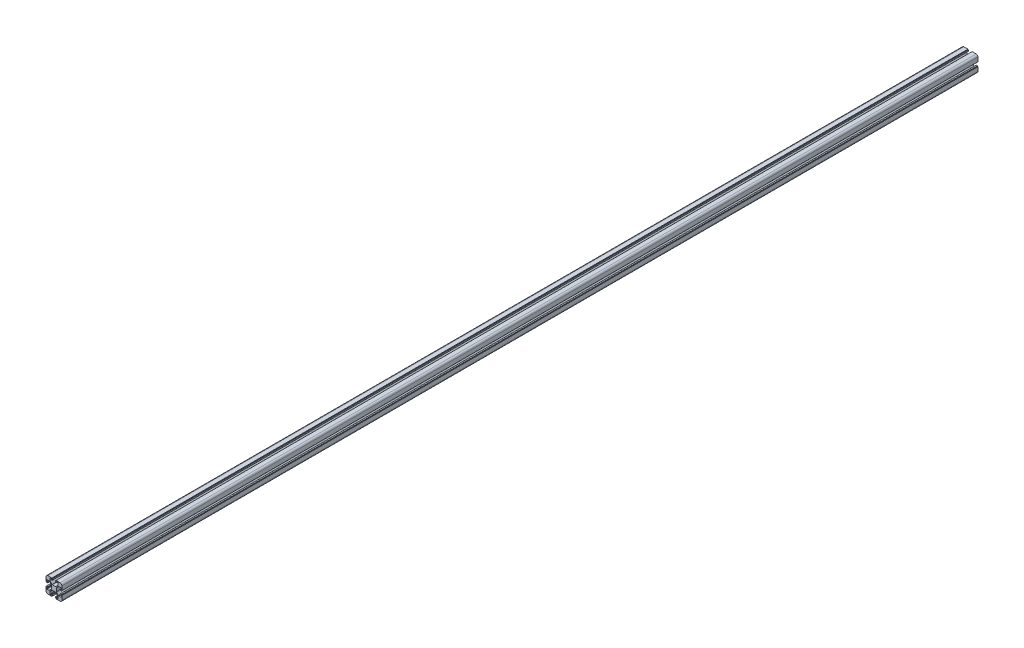
from build123d import *

# Parameters (mm, degrees)
SKETCH2_R           = 3.4
BOSS_EXTRUDE1_DEPTH = 50
BOSS_EXTRUDE2_DEPTH = 2250


with BuildPart() as part:
    # Sketch2 → Boss-Extrude1 (new body)
    with BuildSketch(Plane.XY):
        with BuildLine():
            Line((4.5, 0), (14.7, 0))
            ThreePointArc((14.7, 0), (14.841421356, 0.058578644), (14.9, 0.2))
            Line((14.9, 0.2), (14.9, 0.8))
            ThreePointArc((14.9, 0.8), (14.958578644, 0.941421356), (15.1, 1))
            Line((15.1, 1), (15.7, 1))
            ThreePointArc((15.7, 1), (15.841421356, 1.058578644), (15.9, 1.2))
            Line((15.9, 1.2), (15.9, 4.2))
            ThreePointArc((15.9, 4.2), (15.812132034, 4.412132034), (15.6, 4.5))
            Line((15.6, 4.5), (13.9, 4.5))
            ThreePointArc((13.9, 4.5), (13.687867966, 4.412132034), (13.6, 4.2))
            Line((13.6, 4.2), (13.6, 2.5))
            ThreePointArc((13.6, 2.5), (13.307106781, 1.792893219), (12.6, 1.5))
            Line((12.6, 1.5), (10.75, 1.5))
            ThreePointArc((10.75, 1.5), (10.042893219, 1.792893219), (9.75, 2.5))
            Line((9.75, 2.5), (9.75, 7.507359313))
            ThreePointArc((9.75, 7.507359313), (9.902240935, 8.272726178), (10.335786438, 8.921572875))
            Line((10.335786438, 8.921572875), (14.828427125, 13.414213562))
            ThreePointArc((14.828427125, 13.414213562), (15.477273822, 13.847759065), (16.242640687, 14))
            Line((16.242640687, 14), (23.757359313, 14))
            ThreePointArc((23.757359313, 14), (24.522726178, 13.847759065), (25.171572875, 13.414213562))
            Line((25.171572875, 13.414213562), (29.664213562, 8.921572875))
            ThreePointArc((29.664213562, 8.921572875), (30.097759065, 8.272726178), (30.25, 7.507359313))
            Line((30.25, 7.507359313), (30.25, 2.5))
            ThreePointArc((30.25, 2.5), (29.957106781, 1.792893219), (29.25, 1.5))
            Line((29.25, 1.5), (27.4, 1.5))
            ThreePointArc((27.4, 1.5), (26.692893219, 1.792893219), (26.4, 2.5))
            Line((26.4, 2.5), (26.4, 4.2))
            ThreePointArc((26.4, 4.2), (26.312132034, 4.412132034), (26.1, 4.5))
            Line((26.1, 4.5), (24.4, 4.5))
            ThreePointArc((24.4, 4.5), (24.187867966, 4.412132034), (24.1, 4.2))
            Line((24.1, 4.2), (24.1, 1.2))
            ThreePointArc((24.1, 1.2), (24.158578644, 1.058578644), (24.3, 1))
            Line((24.3, 1), (24.9, 1))
            ThreePointArc((24.9, 1), (25.041421356, 0.941421356), (25.1, 0.8))
            Line((25.1, 0.8), (25.1, 0.2))
            ThreePointArc((25.1, 0.2), (25.158578644, 0.058578644), (25.3, 0))
            Line((25.3, 0), (35.5, 0))
            ThreePointArc((35.5, 0), (38.681980515, 1.318019485), (40, 4.5))
            Line((40, 4.5), (40, 14.7))
            ThreePointArc((40, 14.7), (39.941421356, 14.841421356), (39.8, 14.9))
            Line((39.8, 14.9), (39.2, 14.9))
            ThreePointArc((39.2, 14.9), (39.058578644, 14.958578644), (39, 15.1))
            Line((39, 15.1), (39, 15.7))
            ThreePointArc((39, 15.7), (38.941421356, 15.841421356), (38.8, 15.9))
            Line((38.8, 15.9), (35.8, 15.9))
            ThreePointArc((35.8, 15.9), (35.587867966, 15.812132034), (35.5, 15.6))
            Line((35.5, 15.6), (35.5, 13.9))
            ThreePointArc((35.5, 13.9), (35.587867966, 13.687867966), (35.8, 13.6))
            Line((35.8, 13.6), (37.5, 13.6))
            ThreePointArc((37.5, 13.6), (38.207106781, 13.307106781), (38.5, 12.6))
            Line((38.5, 12.6), (38.5, 10.75))
            ThreePointArc((38.5, 10.75), (38.207106781, 10.042893219), (37.5, 9.75))
            Line((37.5, 9.75), (32.492640687, 9.75))
            ThreePointArc((32.492640687, 9.75), (31.727273822, 9.902240935), (31.078427125, 10.335786438))
            Line((31.078427125, 10.335786438), (26.585786438, 14.828427125))
            ThreePointArc((26.585786438, 14.828427125), (26.152240935, 15.477273822), (26, 16.242640687))
            Line((26, 16.242640687), (26, 23.757359313))
            ThreePointArc((26, 23.757359313), (26.152240935, 24.522726178), (26.585786438, 25.171572875))
            Line((26.585786438, 25.171572875), (31.078427125, 29.664213562))
            ThreePointArc((31.078427125, 29.664213562), (31.727273822, 30.097759065), (32.492640687, 30.25))
            Line((32.492640687, 30.25), (37.5, 30.25))
            ThreePointArc((37.5, 30.25), (38.207106781, 29.957106781), (38.5, 29.25))
            Line((38.5, 29.25), (38.5, 27.4))
            ThreePointArc((38.5, 27.4), (38.207106781, 26.692893219), (37.5, 26.4))
            Line((37.5, 26.4), (35.8, 26.4))
            ThreePointArc((35.8, 26.4), (35.587867966, 26.312132034), (35.5, 26.1))
            Line((35.5, 26.1), (35.5, 24.4))
            ThreePointArc((35.5, 24.4), (35.587867966, 24.187867966), (35.8, 24.1))
            Line((35.8, 24.1), (38.8, 24.1))
            ThreePointArc((38.8, 24.1), (38.941421356, 24.158578644), (39, 24.3))
            Line((39, 24.3), (39, 24.9))
            ThreePointArc((39, 24.9), (39.058578644, 25.041421356), (39.2, 25.1))
            Line((39.2, 25.1), (39.8, 25.1))
            ThreePointArc((39.8, 25.1), (39.941421356, 25.158578644), (40, 25.3))
            Line((40, 25.3), (40, 35.5))
            ThreePointArc((40, 35.5), (38.681980515, 38.681980515), (35.5, 40))
            Line((35.5, 40), (25.3, 40))
            ThreePointArc((25.3, 40), (25.158578644, 39.941421356), (25.1, 39.8))
            Line((25.1, 39.8), (25.1, 39.2))
            ThreePointArc((25.1, 39.2), (25.041421356, 39.058578644), (24.9, 39))
            Line((24.9, 39), (24.3, 39))
            ThreePointArc((24.3, 39), (24.158578644, 38.941421356), (24.1, 38.8))
            Line((24.1, 38.8), (24.1, 35.8))
            ThreePointArc((24.1, 35.8), (24.187867966, 35.587867966), (24.4, 35.5))
            Line((24.4, 35.5), (26.1, 35.5))
            ThreePointArc((26.1, 35.5), (26.312132034, 35.587867966), (26.4, 35.8))
            Line((26.4, 35.8), (26.4, 37.5))
            ThreePointArc((26.4, 37.5), (26.692893219, 38.207106781), (27.4, 38.5))
            Line((27.4, 38.5), (29.25, 38.5))
            ThreePointArc((29.25, 38.5), (29.957106781, 38.207106781), (30.25, 37.5))
            Line((30.25, 37.5), (30.25, 32.492640687))
            ThreePointArc((30.25, 32.492640687), (30.097759065, 31.727273822), (29.664213562, 31.078427125))
            Line((29.664213562, 31.078427125), (25.171572875, 26.585786438))
            ThreePointArc((25.171572875, 26.585786438), (24.522726178, 26.152240935), (23.757359313, 26))
            Line((23.757359313, 26), (16.242640687, 26))
            ThreePointArc((16.242640687, 26), (15.477273822, 26.152240935), (14.828427125, 26.585786438))
            Line((14.828427125, 26.585786438), (10.335786438, 31.078427125))
            ThreePointArc((10.335786438, 31.078427125), (9.902240935, 31.727273822), (9.75, 32.492640687))
            Line((9.75, 32.492640687), (9.75, 37.5))
            ThreePointArc((9.75, 37.5), (10.042893219, 38.207106781), (10.75, 38.5))
            Line((10.75, 38.5), (12.6, 38.5))
            ThreePointArc((12.6, 38.5), (13.307106781, 38.207106781), (13.6, 37.5))
            Line((13.6, 37.5), (13.6, 35.8))
            ThreePointArc((13.6, 35.8), (13.687867966, 35.587867966), (13.9, 35.5))
            Line((13.9, 35.5), (15.6, 35.5))
            ThreePointArc((15.6, 35.5), (15.812132034, 35.587867966), (15.9, 35.8))
            Line((15.9, 35.8), (15.9, 38.8))
            ThreePointArc((15.9, 38.8), (15.841421356, 38.941421356), (15.7, 39))
            Line((15.7, 39), (15.1, 39))
            ThreePointArc((15.1, 39), (14.958578644, 39.058578644), (14.9, 39.2))
            Line((14.9, 39.2), (14.9, 39.8))
            ThreePointArc((14.9, 39.8), (14.841421356, 39.941421356), (14.7, 40))
            Line((14.7, 40), (4.5, 40))
            ThreePointArc((4.5, 40), (1.318019485, 38.681980515), (0, 35.5))
            Line((0, 35.5), (0, 25.3))
            ThreePointArc((0, 25.3), (0.058578644, 25.158578644), (0.2, 25.1))
            Line((0.2, 25.1), (0.8, 25.1))
            ThreePointArc((0.8, 25.1), (0.941421356, 25.041421356), (1, 24.9))
            Line((1, 24.9), (1, 24.3))
            ThreePointArc((1, 24.3), (1.058578644, 24.158578644), (1.2, 24.1))
            Line((1.2, 24.1), (4.2, 24.1))
            ThreePointArc((4.2, 24.1), (4.412132034, 24.187867966), (4.5, 24.4))
            Line((4.5, 24.4), (4.5, 26.1))
            ThreePointArc((4.5, 26.1), (4.412132034, 26.312132034), (4.2, 26.4))
            Line((4.2, 26.4), (2.5, 26.4))
            ThreePointArc((2.5, 26.4), (1.792893219, 26.692893219), (1.5, 27.4))
            Line((1.5, 27.4), (1.5, 29.25))
            ThreePointArc((1.5, 29.25), (1.792893219, 29.957106781), (2.5, 30.25))
            Line((2.5, 30.25), (7.507359313, 30.25))
            ThreePointArc((7.507359313, 30.25), (8.272726178, 30.097759065), (8.921572875, 29.664213562))
            Line((8.921572875, 29.664213562), (13.414213562, 25.171572875))
            ThreePointArc((13.414213562, 25.171572875), (13.847759065, 24.522726178), (14, 23.757359313))
            Line((14, 23.757359313), (14, 16.242640687))
            ThreePointArc((14, 16.242640687), (13.847759065, 15.477273822), (13.414213562, 14.828427125))
            Line((13.414213562, 14.828427125), (8.921572875, 10.335786438))
            ThreePointArc((8.921572875, 10.335786438), (8.272726178, 9.902240935), (7.507359313, 9.75))
            Line((7.507359313, 9.75), (2.5, 9.75))
            ThreePointArc((2.5, 9.75), (1.792893219, 10.042893219), (1.5, 10.75))
            Line((1.5, 10.75), (1.5, 12.6))
            ThreePointArc((1.5, 12.6), (1.792893219, 13.307106781), (2.5, 13.6))
            Line((2.5, 13.6), (4.2, 13.6))
            ThreePointArc((4.2, 13.6), (4.412132034, 13.687867966), (4.5, 13.9))
            Line((4.5, 13.9), (4.5, 15.6))
            ThreePointArc((4.5, 15.6), (4.412132034, 15.812132034), (4.2, 15.9))
            Line((4.2, 15.9), (1.2, 15.9))
            ThreePointArc((1.2, 15.9), (1.058578644, 15.841421356), (1, 15.7))
            Line((1, 15.7), (1, 15.1))
            ThreePointArc((1, 15.1), (0.941421356, 14.958578644), (0.8, 14.9))
            Line((0.8, 14.9), (0.2, 14.9))
            ThreePointArc((0.2, 14.9), (0.058578644, 14.841421356), (0, 14.7))
            Line((0, 14.7), (0, 4.5))
            ThreePointArc((0, 4.5), (1.318019485, 1.318019485), (4.5, 0))
        make_face()
        with Locations((20, 20)):
            Circle(SKETCH2_R, mode=Mode.SUBTRACT)
        with BuildLine():
            Line((31.55, 37.7), (31.55, 32.55))
            ThreePointArc((31.55, 32.55), (31.842893219, 31.842893219), (32.55, 31.55))
            Line((32.55, 31.55), (37.7, 31.55))
            ThreePointArc((37.7, 31.55), (38.407106781, 31.842893219), (38.7, 32.55))
            Line((38.7, 32.55), (38.7, 35.5))
            ThreePointArc((38.7, 35.5), (37.7627417, 37.7627417), (35.5, 38.7))
            Line((35.5, 38.7), (32.55, 38.7))
            ThreePointArc((32.55, 38.7), (31.842893219, 38.407106781), (31.55, 37.7))
        make_face(mode=Mode.SUBTRACT)
        with BuildLine():
            Line((1.3, 35.5), (1.3, 32.55))
            ThreePointArc((1.3, 32.55), (1.592893219, 31.842893219), (2.3, 31.55))
            Line((2.3, 31.55), (7.45, 31.55))
            ThreePointArc((7.45, 31.55), (8.157106781, 31.842893219), (8.45, 32.55))
            Line((8.45, 32.55), (8.45, 37.7))
            ThreePointArc((8.45, 37.7), (8.157106781, 38.407106781), (7.45, 38.7))
            Line((7.45, 38.7), (4.5, 38.7))
            ThreePointArc((4.5, 38.7), (2.2372583, 37.7627417), (1.3, 35.5))
        make_face(mode=Mode.SUBTRACT)
        with BuildLine():
            Line((1.3, 7.45), (1.3, 4.5))
            ThreePointArc((1.3, 4.5), (2.2372583, 2.2372583), (4.5, 1.3))
            Line((4.5, 1.3), (7.45, 1.3))
            ThreePointArc((7.45, 1.3), (8.157106781, 1.592893219), (8.45, 2.3))
            Line((8.45, 2.3), (8.45, 7.45))
            ThreePointArc((8.45, 7.45), (8.157106781, 8.157106781), (7.45, 8.45))
            Line((7.45, 8.45), (2.3, 8.45))
            ThreePointArc((2.3, 8.45), (1.592893219, 8.157106781), (1.3, 7.45))
        make_face(mode=Mode.SUBTRACT)
        with BuildLine():
            Line((31.55, 7.45), (31.55, 2.3))
            ThreePointArc((31.55, 2.3), (31.842893219, 1.592893219), (32.55, 1.3))
            Line((32.55, 1.3), (35.5, 1.3))
            ThreePointArc((35.5, 1.3), (37.7627417, 2.2372583), (38.7, 4.5))
            Line((38.7, 4.5), (38.7, 7.45))
            ThreePointArc((38.7, 7.45), (38.407106781, 8.157106781), (37.7, 8.45))
            Line((37.7, 8.45), (32.55, 8.45))
            ThreePointArc((32.55, 8.45), (31.842893219, 8.157106781), (31.55, 7.45))
        make_face(mode=Mode.SUBTRACT)
    extrude(amount=BOSS_EXTRUDE1_DEPTH)

    # Sketch3 → Boss-Extrude2 (add)
    with BuildSketch(Plane.XY.offset(50)):
        with BuildLine():
            Line((25.3, 0), (35.5, 0))
            ThreePointArc((35.5, 0), (38.681980515, 1.318019485), (40, 4.5))
            Line((40, 4.5), (40, 14.7))
            ThreePointArc((40, 14.7), (39.941421356, 14.841421356), (39.8, 14.9))
            Line((39.8, 14.9), (39.2, 14.9))
            ThreePointArc((39.2, 14.9), (39.058578644, 14.958578644), (39, 15.1))
            Line((39, 15.1), (39, 15.7))
            ThreePointArc((39, 15.7), (38.941421356, 15.841421356), (38.8, 15.9))
            Line((38.8, 15.9), (35.8, 15.9))
            ThreePointArc((35.8, 15.9), (35.587867966, 15.812132034), (35.5, 15.6))
            Line((35.5, 15.6), (35.5, 13.9))
            ThreePointArc((35.5, 13.9), (35.587867966, 13.687867966), (35.8, 13.6))
            Line((35.8, 13.6), (37.5, 13.6))
            ThreePointArc((37.5, 13.6), (38.207106781, 13.307106781), (38.5, 12.6))
            Line((38.5, 12.6), (38.5, 10.75))
            ThreePointArc((38.5, 10.75), (38.207106781, 10.042893219), (37.5, 9.75))
            Line((37.5, 9.75), (32.492640687, 9.75))
            ThreePointArc((32.492640687, 9.75), (31.727273822, 9.902240935), (31.078427125, 10.335786438))
            Line((31.078427125, 10.335786438), (26.585786438, 14.828427125))
            ThreePointArc((26.585786438, 14.828427125), (26.152240935, 15.477273822), (26, 16.242640687))
            Line((26, 16.242640687), (26, 23.757359313))
            ThreePointArc((26, 23.757359313), (26.152240935, 24.522726178), (26.585786438, 25.171572875))
            Line((26.585786438, 25.171572875), (31.078427125, 29.664213562))
            ThreePointArc((31.078427125, 29.664213562), (31.727273822, 30.097759065), (32.492640687, 30.25))
            Line((32.492640687, 30.25), (37.5, 30.25))
            ThreePointArc((37.5, 30.25), (38.207106781, 29.957106781), (38.5, 29.25))
            Line((38.5, 29.25), (38.5, 27.4))
            ThreePointArc((38.5, 27.4), (38.207106781, 26.692893219), (37.5, 26.4))
            Line((37.5, 26.4), (35.8, 26.4))
            ThreePointArc((35.8, 26.4), (35.587867966, 26.312132034), (35.5, 26.1))
            Line((35.5, 26.1), (35.5, 24.4))
            ThreePointArc((35.5, 24.4), (35.587867966, 24.187867966), (35.8, 24.1))
            Line((35.8, 24.1), (38.8, 24.1))
            ThreePointArc((38.8, 24.1), (38.941421356, 24.158578644), (39, 24.3))
            Line((39, 24.3), (39, 24.9))
            ThreePointArc((39, 24.9), (39.058578644, 25.041421356), (39.2, 25.1))
            Line((39.2, 25.1), (39.8, 25.1))
            ThreePointArc((39.8, 25.1), (39.941421356, 25.158578644), (40, 25.3))
            Line((40, 25.3), (40, 35.5))
            ThreePointArc((40, 35.5), (38.681980515, 38.681980515), (35.5, 40))
            Line((35.5, 40), (25.3, 40))
            ThreePointArc((25.3, 40), (25.158578644, 39.941421356), (25.1, 39.8))
            Line((25.1, 39.8), (25.1, 39.2))
            ThreePointArc((25.1, 39.2), (25.041421356, 39.058578644), (24.9, 39))
            Line((24.9, 39), (24.3, 39))
            ThreePointArc((24.3, 39), (24.158578644, 38.941421356), (24.1, 38.8))
            Line((24.1, 38.8), (24.1, 35.8))
            ThreePointArc((24.1, 35.8), (24.187867966, 35.587867966), (24.4, 35.5))
            Line((24.4, 35.5), (26.1, 35.5))
            ThreePointArc((26.1, 35.5), (26.312132034, 35.587867966), (26.4, 35.8))
            Line((26.4, 35.8), (26.4, 37.5))
            ThreePointArc((26.4, 37.5), (26.692893219, 38.207106781), (27.4, 38.5))
            Line((27.4, 38.5), (29.25, 38.5))
            ThreePointArc((29.25, 38.5), (29.957106781, 38.207106781), (30.25, 37.5))
            Line((30.25, 37.5), (30.25, 32.492640687))
            ThreePointArc((30.25, 32.492640687), (30.097759065, 31.727273822), (29.664213562, 31.078427125))
            Line((29.664213562, 31.078427125), (25.171572875, 26.585786438))
            ThreePointArc((25.171572875, 26.585786438), (24.522726178, 26.152240935), (23.757359313, 26))
            Line((23.757359313, 26), (16.242640687, 26))
            ThreePointArc((16.242640687, 26), (15.477273822, 26.152240935), (14.828427125, 26.585786438))
            Line((14.828427125, 26.585786438), (10.335786438, 31.078427125))
            ThreePointArc((10.335786438, 31.078427125), (9.902240935, 31.727273822), (9.75, 32.492640687))
            Line((9.75, 32.492640687), (9.75, 37.5))
            ThreePointArc((9.75, 37.5), (10.042893219, 38.207106781), (10.75, 38.5))
            Line((10.75, 38.5), (12.6, 38.5))
            ThreePointArc((12.6, 38.5), (13.307106781, 38.207106781), (13.6, 37.5))
            Line((13.6, 37.5), (13.6, 35.8))
            ThreePointArc((13.6, 35.8), (13.687867966, 35.587867966), (13.9, 35.5))
            Line((13.9, 35.5), (15.6, 35.5))
            ThreePointArc((15.6, 35.5), (15.812132034, 35.587867966), (15.9, 35.8))
            Line((15.9, 35.8), (15.9, 38.8))
            ThreePointArc((15.9, 38.8), (15.841421356, 38.941421356), (15.7, 39))
            Line((15.7, 39), (15.1, 39))
            ThreePointArc((15.1, 39), (14.958578644, 39.058578644), (14.9, 39.2))
            Line((14.9, 39.2), (14.9, 39.8))
            ThreePointArc((14.9, 39.8), (14.841421356, 39.941421356), (14.7, 40))
            Line((14.7, 40), (4.5, 40))
            ThreePointArc((4.5, 40), (1.318019485, 38.681980515), (0, 35.5))
            Line((0, 35.5), (0, 25.3))
            ThreePointArc((0, 25.3), (0.058578644, 25.158578644), (0.2, 25.1))
            Line((0.2, 25.1), (0.8, 25.1))
            ThreePointArc((0.8, 25.1), (0.941421356, 25.041421356), (1, 24.9))
            Line((1, 24.9), (1, 24.3))
            ThreePointArc((1, 24.3), (1.058578644, 24.158578644), (1.2, 24.1))
            Line((1.2, 24.1), (4.2, 24.1))
            ThreePointArc((4.2, 24.1), (4.412132034, 24.187867966), (4.5, 24.4))
            Line((4.5, 24.4), (4.5, 26.1))
            ThreePointArc((4.5, 26.1), (4.412132034, 26.312132034), (4.2, 26.4))
            Line((4.2, 26.4), (2.5, 26.4))
            ThreePointArc((2.5, 26.4), (1.792893219, 26.692893219), (1.5, 27.4))
            Line((1.5, 27.4), (1.5, 29.25))
            ThreePointArc((1.5, 29.25), (1.792893219, 29.957106781), (2.5, 30.25))
            Line((2.5, 30.25), (7.507359313, 30.25))
            ThreePointArc((7.507359313, 30.25), (8.272726178, 30.097759065), (8.921572875, 29.664213562))
            Line((8.921572875, 29.664213562), (13.414213562, 25.171572875))
            ThreePointArc((13.414213562, 25.171572875), (13.847759065, 24.522726178), (14, 23.757359313))
            Line((14, 23.757359313), (14, 16.242640687))
            ThreePointArc((14, 16.242640687), (13.847759065, 15.477273822), (13.414213562, 14.828427125))
            Line((13.414213562, 14.828427125), (8.921572875, 10.335786438))
            ThreePointArc((8.921572875, 10.335786438), (8.272726178, 9.902240935), (7.507359313, 9.75))
            Line((7.507359313, 9.75), (2.5, 9.75))
            ThreePointArc((2.5, 9.75), (1.792893219, 10.042893219), (1.5, 10.75))
            Line((1.5, 10.75), (1.5, 12.6))
            ThreePointArc((1.5, 12.6), (1.792893219, 13.307106781), (2.5, 13.6))
            Line((2.5, 13.6), (4.2, 13.6))
            ThreePointArc((4.2, 13.6), (4.412132034, 13.687867966), (4.5, 13.9))
            Line((4.5, 13.9), (4.5, 15.6))
            ThreePointArc((4.5, 15.6), (4.412132034, 15.812132034), (4.2, 15.9))
            Line((4.2, 15.9), (1.2, 15.9))
            ThreePointArc((1.2, 15.9), (1.058578644, 15.841421356), (1, 15.7))
            Line((1, 15.7), (1, 15.1))
            ThreePointArc((1, 15.1), (0.941421356, 14.958578644), (0.8, 14.9))
            Line((0.8, 14.9), (0.2, 14.9))
            ThreePointArc((0.2, 14.9), (0.058578644, 14.841421356), (0, 14.7))
            Line((0, 14.7), (0, 4.5))
            ThreePointArc((0, 4.5), (1.318019485, 1.318019485), (4.5, 0))
            Line((4.5, 0), (14.7, 0))
            ThreePointArc((14.7, 0), (14.841421356, 0.058578644), (14.9, 0.2))
            Line((14.9, 0.2), (14.9, 0.8))
            ThreePointArc((14.9, 0.8), (14.958578644, 0.941421356), (15.1, 1))
            Line((15.1, 1), (15.7, 1))
            ThreePointArc((15.7, 1), (15.841421356, 1.058578644), (15.9, 1.2))
            Line((15.9, 1.2), (15.9, 4.2))
            ThreePointArc((15.9, 4.2), (15.812132034, 4.412132034), (15.6, 4.5))
            Line((15.6, 4.5), (13.9, 4.5))
            ThreePointArc((13.9, 4.5), (13.687867966, 4.412132034), (13.6, 4.2))
            Line((13.6, 4.2), (13.6, 2.5))
            ThreePointArc((13.6, 2.5), (13.307106781, 1.792893219), (12.6, 1.5))
            Line((12.6, 1.5), (10.75, 1.5))
            ThreePointArc((10.75, 1.5), (10.042893219, 1.792893219), (9.75, 2.5))
            Line((9.75, 2.5), (9.75, 7.507359313))
            ThreePointArc((9.75, 7.507359313), (9.902240935, 8.272726178), (10.335786438, 8.921572875))
            Line((10.335786438, 8.921572875), (14.828427125, 13.414213562))
            ThreePointArc((14.828427125, 13.414213562), (15.477273822, 13.847759065), (16.242640687, 14))
            Line((16.242640687, 14), (23.757359313, 14))
            ThreePointArc((23.757359313, 14), (24.522726178, 13.847759065), (25.171572875, 13.414213562))
            Line((25.171572875, 13.414213562), (29.664213562, 8.921572875))
            ThreePointArc((29.664213562, 8.921572875), (30.097759065, 8.272726178), (30.25, 7.507359313))
            Line((30.25, 7.507359313), (30.25, 2.5))
            ThreePointArc((30.25, 2.5), (29.957106781, 1.792893219), (29.25, 1.5))
            Line((29.25, 1.5), (27.4, 1.5))
            ThreePointArc((27.4, 1.5), (26.692893219, 1.792893219), (26.4, 2.5))
            Line((26.4, 2.5), (26.4, 4.2))
            ThreePointArc((26.4, 4.2), (26.312132034, 4.412132034), (26.1, 4.5))
            Line((26.1, 4.5), (24.4, 4.5))
            ThreePointArc((24.4, 4.5), (24.187867966, 4.412132034), (24.1, 4.2))
            Line((24.1, 4.2), (24.1, 1.2))
            ThreePointArc((24.1, 1.2), (24.158578644, 1.058578644), (24.3, 1))
            Line((24.3, 1), (24.9, 1))
            ThreePointArc((24.9, 1), (25.041421356, 0.941421356), (25.1, 0.8))
            Line((25.1, 0.8), (25.1, 0.2))
            ThreePointArc((25.1, 0.2), (25.158578644, 0.058578644), (25.3, 0))
        make_face()
    extrude(amount=BOSS_EXTRUDE2_DEPTH)


solid = part.part
